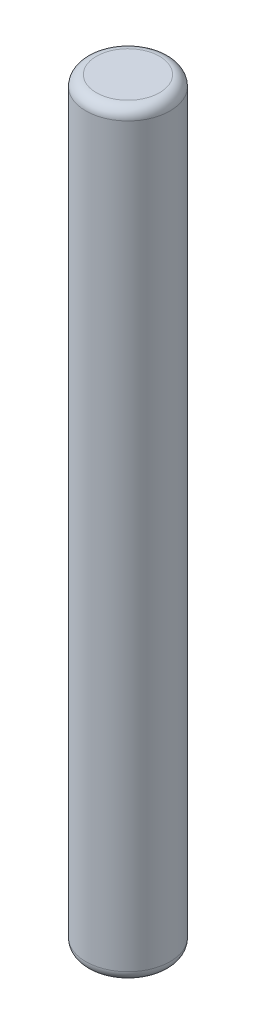
from build123d import *

# Parameters (mm, degrees)
ESQUISSE1_R        = 1
BOSS_EXTRU_1_DEPTH = 18
CONG_1_R           = 0.25


with BuildPart() as part:
    # Esquisse1 → Boss.-Extru.1 (new body)
    with BuildSketch(Plane(origin=(0, 0, 0), x_dir=(1, 0, 0), z_dir=(0, 1, 0))):
        with Locations(Location((0, 0, 0), (0, 0, 270))):
            Circle(ESQUISSE1_R)
    extrude(amount=BOSS_EXTRU_1_DEPTH)

    # Congé1
    cong_1_edges = [part.edges().sort_by_distance(p)[0] for p in [
        (0, 0, -1),
        (0, 18, -1),
    ]]
    fillet(cong_1_edges, radius=CONG_1_R)


solid = part.part
